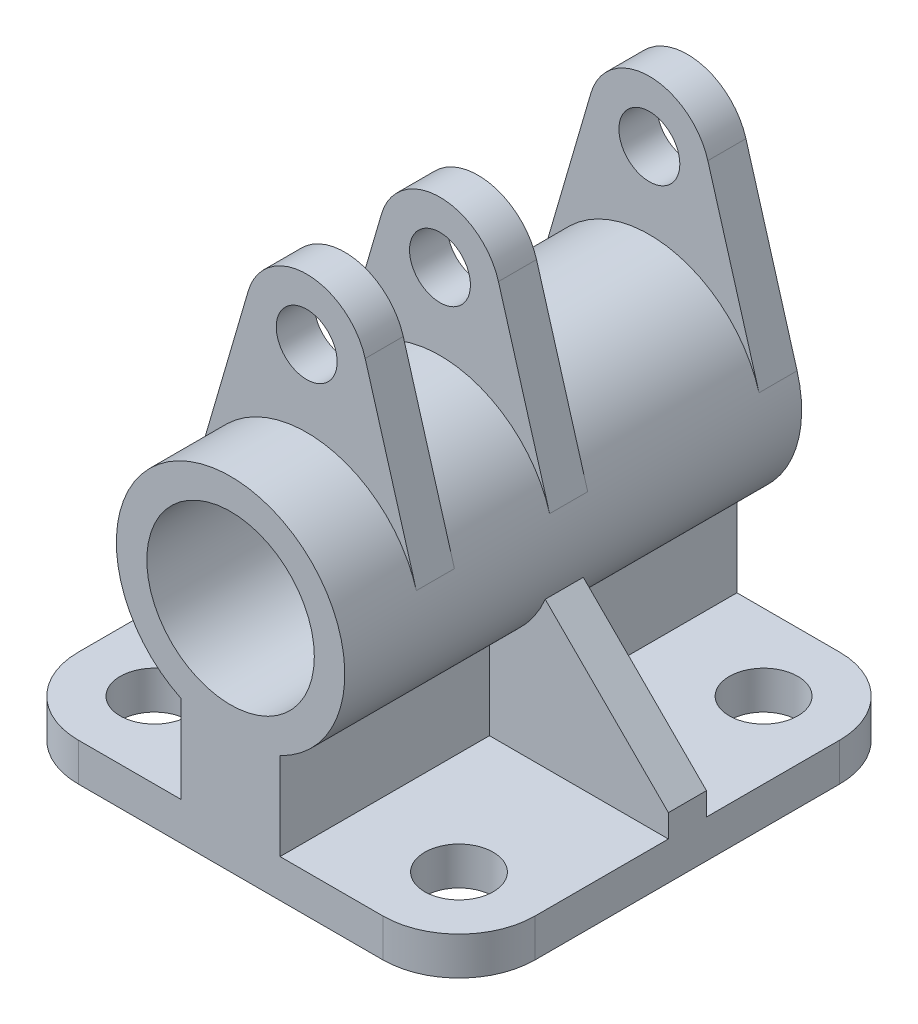
from build123d import *
from build123d.topology import SkipClean

# Parameters (mm, degrees)
EXTRUDE_5_DEPTH     = 30
EXTRUDE_7_DEPTH     = 2.5
EXTRUDE_START       = 20
EXTRUDE_8_DEPTH     = 5
EXTRUDE_START_2     = -25
EXTRUDE_9_DEPTH     = 5
SKETCH_3_R          = 4.500000000000002
CUT_EXTRUDE_1_DEPTH = 76.95393340703298
FILLET_1_R          = 10


with BuildPart() as part:
    # Эскиз1 → Бобышка-Вытянуть5 (new, symmetric)
    with BuildSketch(Plane.XY):
        with BuildLine():
            ThreePointArc((15, 0), (14.849242404917499, 2.1213203435596406), (14.4, 4.199999999999996))
            ThreePointArc((14.4, 4.199999999999997), (8.99999999999986, 12.000000000000105), (-3.5546e-13, 15))
            Line((0, 15), (0, 11))
            ThreePointArc((1.044e-14, 11), (7.778174593052027, 7.77817459305202), (11, 0))
            ThreePointArc((11, -2.69e-15), (7.778174593052021, -7.778174593052024), (-2.02e-15, -11))
            Line((0, -11), (0, -15))
            ThreePointArc((-3.4915e-13, -15), (3.3333476027157003, -14.624937393352134), (6.499999999999997, -13.518505834595777))
            ThreePointArc((6.499999999999997, -13.518505834595777), (10.865729218331289, -10.340982958785965), (13.823441352194198, -5.823441352194374))
            ThreePointArc((13.823441352194198, -5.823441352194374), (14.702918422594083, -2.9705537966082223), (15, -3.67e-15))
        make_face()
        with BuildLine():
            ThreePointArc((-3.5546e-13, 15), (-9.000000000000142, 11.999999999999893), (-14.4, 4.1999999999999975))
            ThreePointArc((-14.4, 4.1999999999999975), (-14.975246394480674, -0.8613915628757801), (-13.8234413521942, -5.823441352194369))
            ThreePointArc((-13.8234413521942, -5.823441352194369), (-10.86572921833129, -10.340982958785961), (-6.500000000000014, -13.518505834595768))
            ThreePointArc((-6.500000000000014, -13.518505834595768), (-3.333347602716056, -14.624937393352052), (-3.4915e-13, -15))
            Line((0, -15), (0, -11))
            ThreePointArc((-2.02e-15, -11), (-11, 6.23e-15), (1.044e-14, 11))
            Line((0, 11), (0, 15))
        make_face()
        with BuildLine():
            Line((6.500000000000005, -24.999999999999996), (6.500000000000004, -13.518505834595771))
            ThreePointArc((6.499999999999997, -13.518505834595777), (3.3333476027157003, -14.624937393352134), (-3.4915e-13, -15))
            Line((0, -15), (0, -30))
            Line((0, -29.999999999999993), (30.000000000000007, -29.999999999999993))
            Line((30.000000000000007, -29.999999999999993), (30.000000000000007, -24.999999999999996))
            Line((30.000000000000007, -24.999999999999996), (6.500000000000005, -24.999999999999996))
        make_face()
        with BuildLine():
            ThreePointArc((-3.4915e-13, -15), (-3.333347602716056, -14.624937393352052), (-6.500000000000014, -13.518505834595768))
            Line((-6.500000000000004, -13.518505834595771), (-6.500000000000005, -24.999999999999996))
            Line((-6.500000000000005, -24.999999999999996), (-30.000000000000007, -24.999999999999996))
            Line((-30.000000000000007, -24.999999999999996), (-30.000000000000007, -29.999999999999993))
            Line((-30.000000000000007, -29.999999999999993), (0, -29.999999999999993))
            Line((0, -30), (0, -15))
        make_face()
    extrude(amount=EXTRUDE_5_DEPTH, both=True)

    # Эскиз1<6> → Бобышка-Вытянуть7 (add, symmetric)
    with SkipClean():  # the faces are left unmerged after this step: merging them gives an invalid solid
        with BuildSketch(Plane.XY):
            with BuildLine():
                ThreePointArc((7.680000000000005, 27.240000000000002), (4.800000000000143, 31.399999999999896), (3.5438e-13, 33))
                Line((0, 33), (0, 29))
                ThreePointArc((-1.233e-13, 29), (2.828427124746149, 27.828427124746234), (4.0000000000000036, 25))
                ThreePointArc((4.0000000000000036, 25), (2.8284271247461503, 22.171572875253766), (-1.2161e-13, 21))
                Line((0, 21), (0, 15))
                ThreePointArc((-3.5546e-13, 15), (8.99999999999986, 12.000000000000105), (14.4, 4.199999999999997))
                Line((14.400000000000004, 4.199999999999996), (7.680000000000005, 27.240000000000002))
            make_face()
            with BuildLine():
                Line((0, 29), (0, 33))
                ThreePointArc((3.5438e-13, 33), (-4.799999999999857, 31.40000000000011), (-7.680000000000003, 27.240000000000006))
                Line((-7.680000000000005, 27.240000000000002), (-14.400000000000004, 4.199999999999996))
                ThreePointArc((-14.4, 4.1999999999999975), (-9.000000000000142, 11.999999999999893), (-3.5546e-13, 15))
                Line((0, 15), (0, 21))
                ThreePointArc((-1.2161e-13, 21), (-3.9999999999999964, 25), (-1.233e-13, 29))
            make_face()
            with BuildLine():
                Line((30.000000000000007, -21.999999999999993), (13.823441352194202, -5.823441352194365))
                ThreePointArc((13.823441352194198, -5.823441352194374), (10.865729218331289, -10.340982958785965), (6.499999999999997, -13.518505834595777))
                Line((6.500000000000004, -13.518505834595771), (6.500000000000005, -24.999999999999996))
                Line((6.500000000000005, -24.999999999999996), (30.000000000000007, -24.999999999999996))
                Line((30.000000000000007, -24.999999999999996), (30.000000000000007, -21.999999999999993))
            make_face()
            with BuildLine():
                ThreePointArc((-6.500000000000014, -13.518505834595768), (-10.86572921833129, -10.340982958785961), (-13.8234413521942, -5.823441352194369))
                Line((-13.823441352194195, -5.823441352194372), (-30.000000000000007, -21.999999999999993))
                Line((-30.000000000000007, -21.999999999999993), (-30.000000000000007, -24.999999999999996))
                Line((-30.000000000000007, -24.999999999999996), (-6.500000000000005, -24.999999999999996))
                Line((-6.500000000000005, -24.999999999999996), (-6.500000000000004, -13.518505834595771))
            make_face()
        extrude(amount=EXTRUDE_7_DEPTH, both=True)

    # Эскиз1<8> → Бобышка-Вытянуть8 (add)
    with BuildSketch(Plane.XY.offset(EXTRUDE_START)):
        with BuildLine():
            ThreePointArc((7.680000000000005, 27.240000000000002), (4.800000000000143, 31.399999999999896), (3.5438e-13, 33))
            Line((0, 33), (0, 29))
            ThreePointArc((-1.233e-13, 29), (2.828427124746149, 27.828427124746234), (4.0000000000000036, 25))
            ThreePointArc((4.0000000000000036, 25), (2.8284271247461503, 22.171572875253766), (-1.2161e-13, 21))
            Line((0, 21), (0, 15))
            ThreePointArc((-3.5546e-13, 15), (8.99999999999986, 12.000000000000105), (14.4, 4.199999999999997))
            Line((14.400000000000004, 4.199999999999996), (7.680000000000005, 27.240000000000002))
        make_face()
        with BuildLine():
            Line((0, 29), (0, 33))
            ThreePointArc((3.5438e-13, 33), (-4.799999999999857, 31.40000000000011), (-7.680000000000003, 27.240000000000006))
            Line((-7.680000000000005, 27.240000000000002), (-14.400000000000004, 4.199999999999996))
            ThreePointArc((-14.4, 4.1999999999999975), (-9.000000000000142, 11.999999999999893), (-3.5546e-13, 15))
            Line((0, 15), (0, 21))
            ThreePointArc((-1.2161e-13, 21), (-3.9999999999999964, 25), (-1.233e-13, 29))
        make_face()
    extrude(amount=-EXTRUDE_8_DEPTH)

    # Эскиз1<9> → Бобышка-Вытянуть9 (add)
    with BuildSketch(Plane.XY.offset(EXTRUDE_START_2)):
        with BuildLine():
            Line((0, 29), (0, 33))
            ThreePointArc((3.5438e-13, 33), (-4.799999999999857, 31.40000000000011), (-7.680000000000003, 27.240000000000006))
            Line((-7.680000000000005, 27.240000000000002), (-14.400000000000004, 4.199999999999996))
            ThreePointArc((-14.4, 4.1999999999999975), (-9.000000000000142, 11.999999999999893), (-3.5546e-13, 15))
            Line((0, 15), (0, 21))
            ThreePointArc((-1.2161e-13, 21), (-3.9999999999999964, 25), (-1.233e-13, 29))
        make_face()
        with BuildLine():
            ThreePointArc((7.680000000000005, 27.240000000000002), (4.800000000000143, 31.399999999999896), (3.5438e-13, 33))
            Line((0, 33), (0, 29))
            ThreePointArc((-1.233e-13, 29), (2.828427124746149, 27.828427124746234), (4.0000000000000036, 25))
            ThreePointArc((4.0000000000000036, 25), (2.8284271247461503, 22.171572875253766), (-1.2161e-13, 21))
            Line((0, 21), (0, 15))
            ThreePointArc((-3.5546e-13, 15), (8.99999999999986, 12.000000000000105), (14.4, 4.199999999999997))
            Line((14.400000000000004, 4.199999999999996), (7.680000000000005, 27.240000000000002))
        make_face()
    extrude(amount=-EXTRUDE_9_DEPTH)

    # Эскиз3 → Вырез-Вытянуть1 (cut, through all)
    with BuildSketch(Plane.XZ.offset(29.999999999999993)):
        with Locations(Location((20.000000000000007, -20.000000000000004, 0), (0, 0, 270))):
            Circle(SKETCH_3_R)
        with Locations(Location((20.000000000000007, 20.000000000000004, 0), (0, 0, 90))):
            Circle(SKETCH_3_R)
        with Locations(Location((-20.000000000000007, -20.000000000000004, 0), (0, 0, 270))):
            Circle(SKETCH_3_R)
        with Locations(Location((-20.000000000000007, 20.000000000000004, 0), (0, 0, 270))):
            Circle(SKETCH_3_R)
    extrude(amount=-CUT_EXTRUDE_1_DEPTH, mode=Mode.SUBTRACT)

    # Скругление1
    fillet_1_edges = [part.edges().sort_by_distance(p)[0] for p in [
        (30.000000000000007, -27.499999999999993, -30),
        (-30.000000000000007, -27.499999999999993, -30),
        (30.000000000000007, -27.499999999999993, 30),
        (-30.000000000000007, -27.499999999999993, 30),
    ]]
    fillet(fillet_1_edges, radius=FILLET_1_R)


solid = part.part
